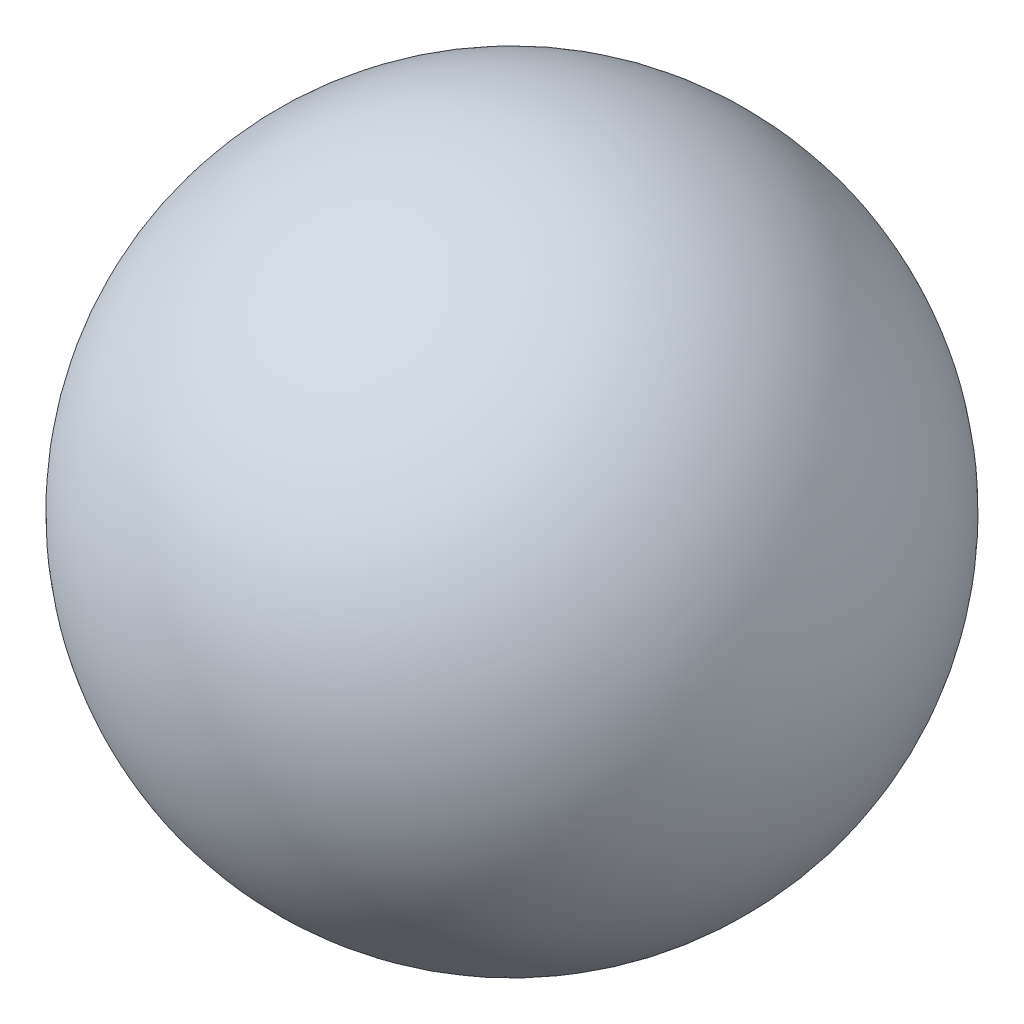
from build123d import *


with BuildPart() as part:
    # Sketch1 → Revolve1 (revolve)
    with BuildSketch(Plane(origin=(0, 0, 0), x_dir=(1, 0, 0), z_dir=(0, 1, 0))):
        with BuildLine():
            Line((0, 7.874), (0, -7.874))
            ThreePointArc((0, -7.874), (7.874, 0), (0, 7.874))
        make_face()
    revolve(axis=Axis((0, 0, -54.85198012), (0, 0, 1)))


solid = part.part
